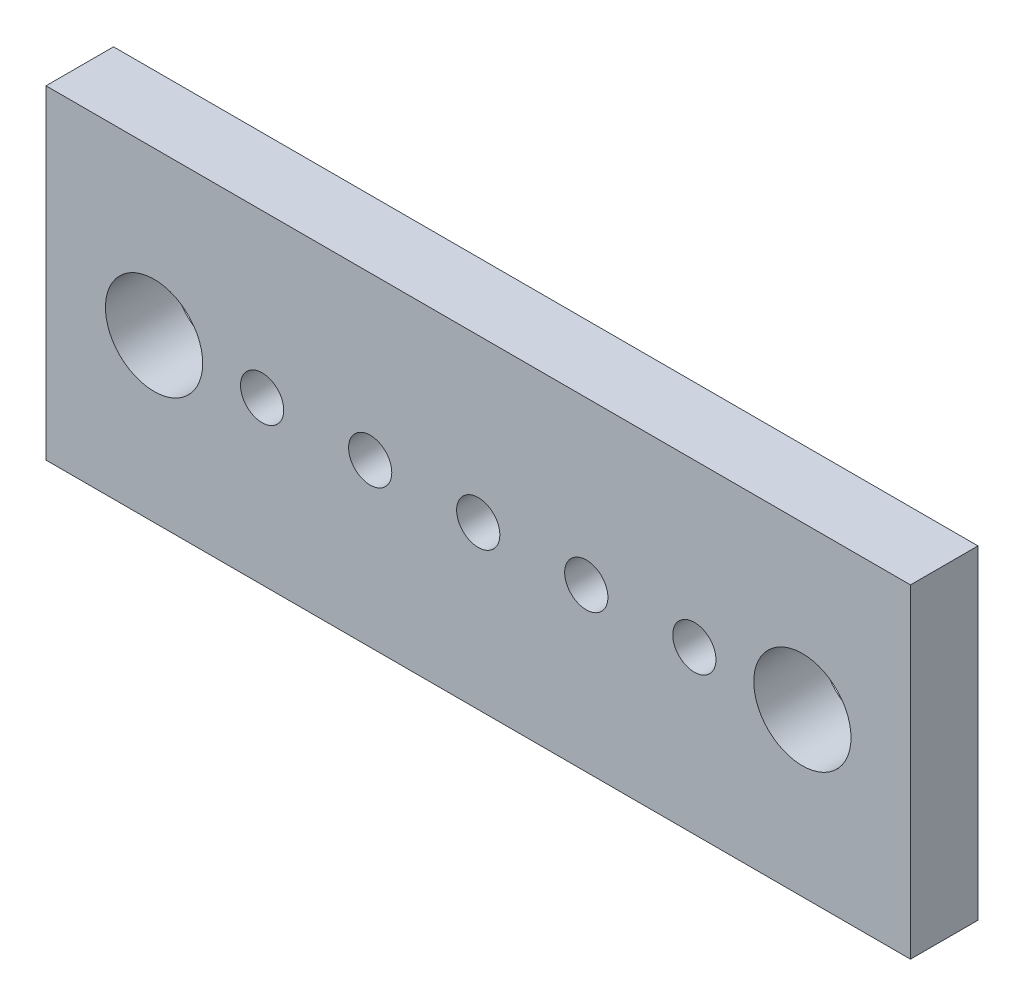
from build123d import *

# Parameters (mm, degrees)
SKETCH1_W           = 20.32
SKETCH1_H           = 7.62
SKETCH1_R           = 0.508
BOSS_EXTRUDE1_DEPTH = 1.5875
SKETCH2_R           = 1.143
CUT_EXTRUDE1_DEPTH  = 22.759755427


with BuildPart() as part:
    # Sketch1 → Boss-Extrude1 (new body)
    with BuildSketch(Plane.XY):
        with Locations((10.16, 3.81)):
            Rectangle(SKETCH1_W, SKETCH1_H)
        with Locations((2.54, 3.81)):
            Circle(SKETCH1_R, mode=Mode.SUBTRACT)
        with Locations((5.08, 3.81)):
            Circle(SKETCH1_R, mode=Mode.SUBTRACT)
        with Locations((7.62, 3.81)):
            Circle(SKETCH1_R, mode=Mode.SUBTRACT)
        with Locations((10.16, 3.81)):
            Circle(SKETCH1_R, mode=Mode.SUBTRACT)
        with Locations((12.7, 3.81)):
            Circle(SKETCH1_R, mode=Mode.SUBTRACT)
        with Locations((15.24, 3.81)):
            Circle(SKETCH1_R, mode=Mode.SUBTRACT)
        with Locations((17.78, 3.81)):
            Circle(SKETCH1_R, mode=Mode.SUBTRACT)
    extrude(amount=BOSS_EXTRUDE1_DEPTH)

    # Sketch2 → Cut-Extrude1 (cut, through all)
    with BuildSketch(Plane.XY.offset(1.5875)):
        with Locations((2.54, 3.81)):
            Circle(SKETCH2_R)
        with Locations((17.78, 3.81)):
            Circle(SKETCH2_R)
    extrude(amount=-CUT_EXTRUDE1_DEPTH, mode=Mode.SUBTRACT)


solid = part.part
